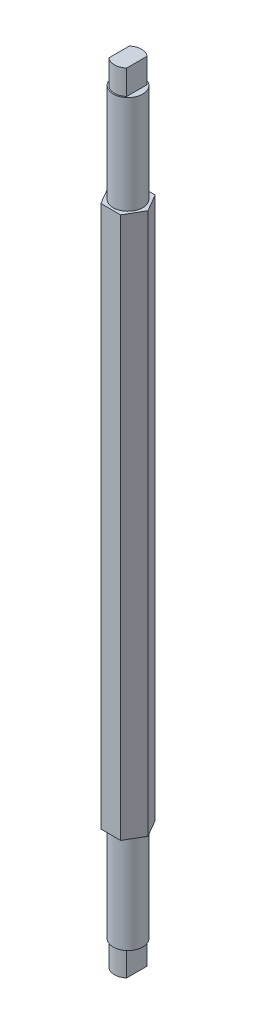
from build123d import *

# Parameters (mm, degrees)
Y_KSEKLIK_EKSTR_ZYON1_DEPTH = 110
IZIM2_R                     = 3
Y_KSEKLIK_EKSTR_ZYON2_DEPTH = 20
Y_KSEKLIK_EKSTR_ZYON3_DEPTH = 5
Y_KSEKLIK_EKSTR_ZYON4_START = 20
IZIM4_R                     = 3
Y_KSEKLIK_EKSTR_ZYON4_DEPTH = 20
Y_KSEKLIK_EKSTR_ZYON5_START = 5
Y_KSEKLIK_EKSTR_ZYON5_DEPTH = 5


with BuildPart() as part:
    # Çizim1 → Yükseklik-Ekstrüzyon1 (new body)
    with BuildSketch(Plane(origin=(0, 0, 0), x_dir=(1, 0, 0), z_dir=(0, 1, 0))):
        Polygon((4.041451884, 0), (2.020725942, 3.5), (-2.020725942, 3.5), (-4.041451884, 0), (-2.020725942, -3.5), (2.020725942, -3.5), align=None)
    extrude(amount=Y_KSEKLIK_EKSTR_ZYON1_DEPTH)

    # Çizim2 → Yükseklik-Ekstrüzyon2 (add)
    with BuildSketch(Plane(origin=(0, 110, 0), x_dir=(1, 0, 0), z_dir=(0, 1, 0))):
        with Locations(Location((0, 0, 0), (0, 0, 270))):
            Circle(IZIM2_R)
    extrude(amount=Y_KSEKLIK_EKSTR_ZYON2_DEPTH)

    # Çizim3 → Yükseklik-Ekstrüzyon3 (add)
    with BuildSketch(Plane(origin=(0, 130, 0), x_dir=(1, 0, 0), z_dir=(0, 1, 0))):
        with BuildLine():
            ThreePointArc((1.79891634, 2.08), (0, 2.75), (-1.79891634, 2.08))
            Line((-1.79891634, 2.08), (-1.79891634, -2.08))
            ThreePointArc((-1.79891634, -2.08), (0, -2.75), (1.79891634, -2.08))
            Line((1.79891634, -2.08), (1.79891634, 2.08))
        make_face()
    extrude(amount=Y_KSEKLIK_EKSTR_ZYON3_DEPTH)

    # Çizim4 → Yükseklik-Ekstrüzyon4 (add)
    with BuildSketch(Plane.XZ.offset(Y_KSEKLIK_EKSTR_ZYON4_START)):
        with Locations(Location((0, 0, 0), (0, 0, 90))):
            Circle(IZIM4_R)
    extrude(amount=-Y_KSEKLIK_EKSTR_ZYON4_DEPTH)

    # Çizim5 → Yükseklik-Ekstrüzyon5 (add)
    with BuildSketch(Plane.XZ.offset(20).offset(Y_KSEKLIK_EKSTR_ZYON5_START)):
        with BuildLine():
            ThreePointArc((1.79891634, 2.08), (0, 2.75), (-1.79891634, 2.08))
            Line((-1.79891634, 2.08), (-1.79891634, -2.08))
            ThreePointArc((-1.79891634, -2.08), (0, -2.75), (1.79891634, -2.08))
            Line((1.79891634, -2.08), (1.79891634, 2.08))
        make_face()
    extrude(amount=-Y_KSEKLIK_EKSTR_ZYON5_DEPTH)


solid = part.part
